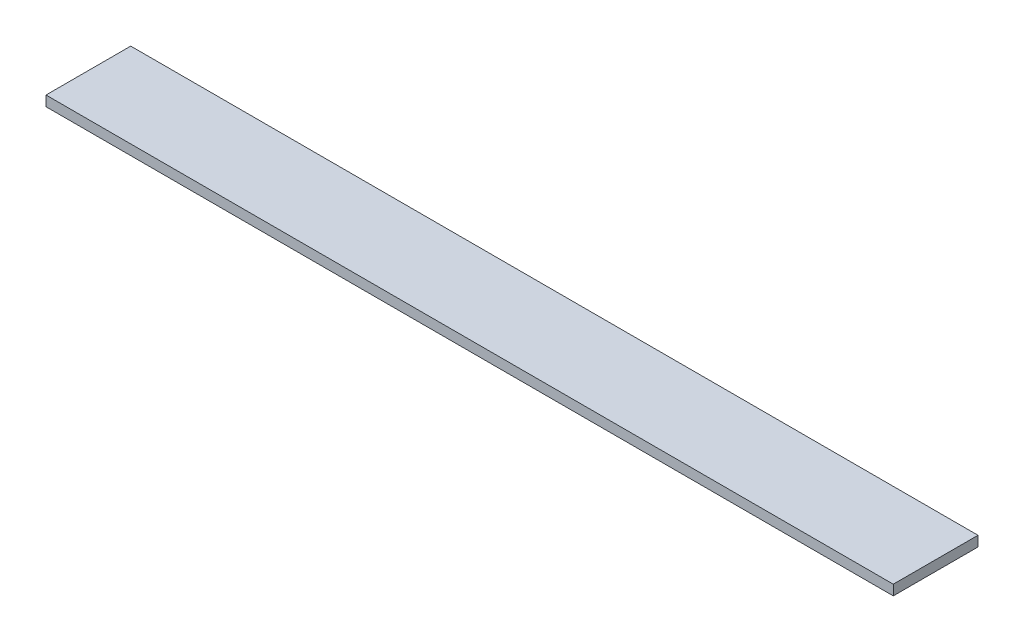
from build123d import *

# Parameters (mm, degrees)
SCHIZZO1_W                   = 2500
SCHIZZO1_H                   = 250
ESTRUSIONE_ESTRUSIONE1_DEPTH = 30


with BuildPart() as part:
    # Schizzo1 → Estrusione-Estrusione1 (new body)
    with BuildSketch(Plane(origin=(0, 0, 0), x_dir=(1, 0, 0), z_dir=(0, 1, 0))):
        with Locations((1250, 125)):
            Rectangle(SCHIZZO1_W, SCHIZZO1_H)
    extrude(amount=ESTRUSIONE_ESTRUSIONE1_DEPTH)


solid = part.part
